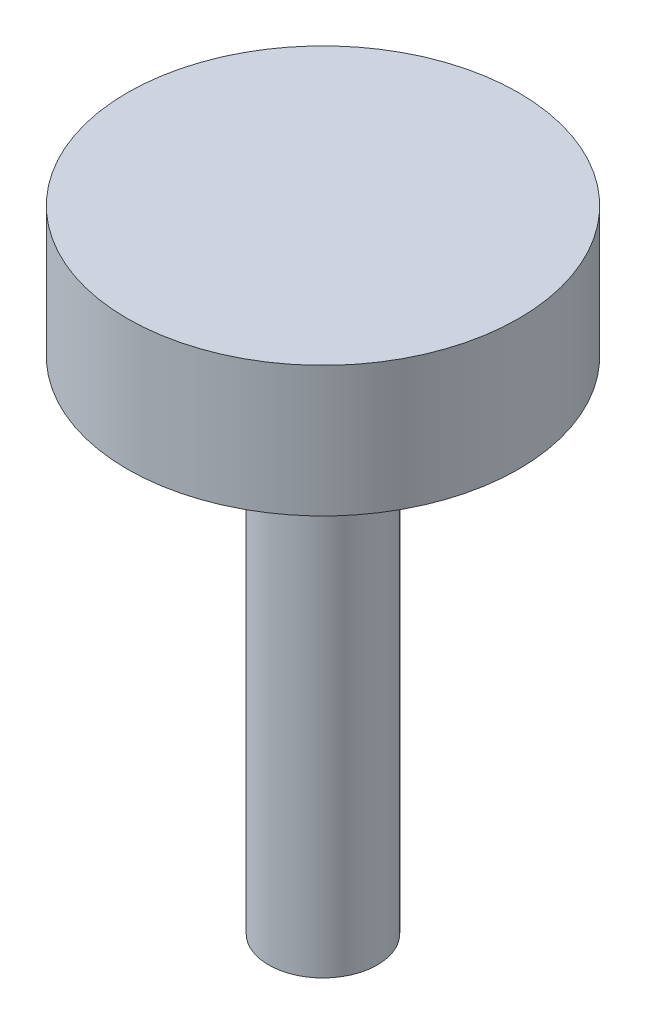
from build123d import *

# Parameters (mm, degrees)
SKETCH1_R           = 45
BOSS_EXTRUDE1_DEPTH = 30
SKETCH2_R           = 12.5
BOSS_EXTRUDE2_DEPTH = 115


with BuildPart() as part:
    # Sketch1 → Boss-Extrude1 (new body)
    with BuildSketch(Plane(origin=(0, 0, 0), x_dir=(1, 0, 0), z_dir=(0, 1, 0))):
        with Locations(Location((0, 0, 0), (0, 0, 270))):
            Circle(SKETCH1_R)
    extrude(amount=BOSS_EXTRUDE1_DEPTH)

    # Sketch2 → Boss-Extrude2 (add)
    with BuildSketch(Plane.XZ):
        with Locations(Location((0, 0, 0), (0, 0, 270))):
            Circle(SKETCH2_R)
    extrude(amount=BOSS_EXTRUDE2_DEPTH)


solid = part.part
